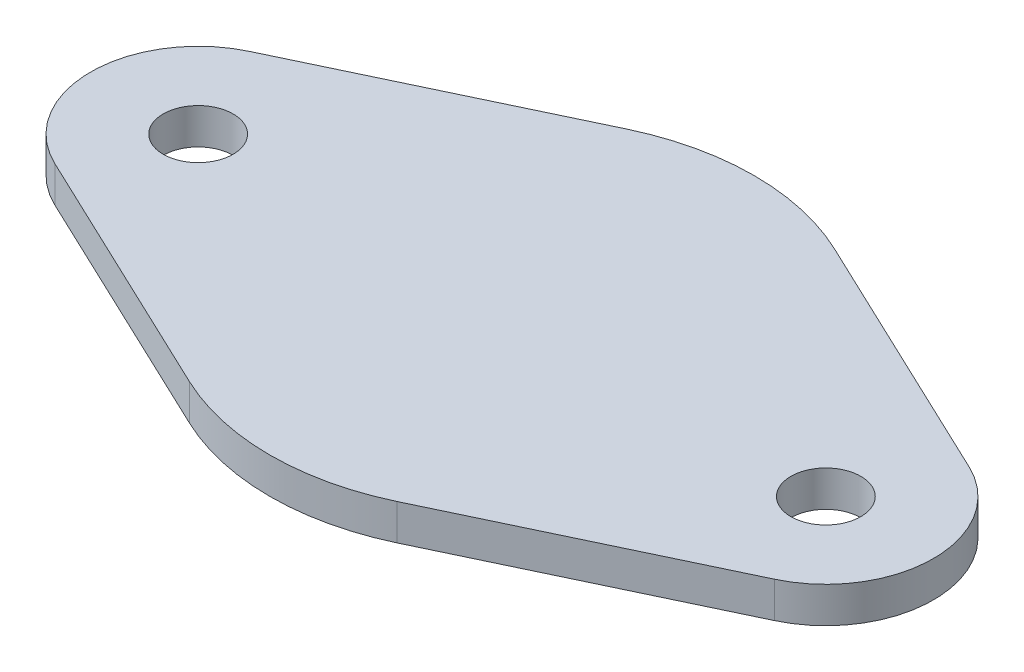
from build123d import *

# Parameters (mm, degrees)
SKETCH_1_R      = 1.95
EXTRUDE_1_DEPTH = 2


with BuildPart() as part:
    # 草图1 → 凸台-拉伸1 (new body)
    with BuildSketch(Plane(origin=(0, 0, 0), x_dir=(1, 0, 0), z_dir=(0, 1, 0))):
        with BuildLine():
            Line((-5.785714286, 12.197356689), (-20.071428571, 5.421047417))
            ThreePointArc((-20.071428571, 5.421047417), (-23.5, 0), (-20.071428571, -5.421047417))
            Line((-20.071428571, -5.421047417), (-5.785714286, -12.197356689))
            ThreePointArc((-5.785714286, -12.197356689), (0, -13.5), (5.785714286, -12.197356689))
            Line((5.785714286, -12.197356689), (20.071428571, -5.421047417))
            ThreePointArc((20.071428571, -5.421047417), (23.5, 0), (20.071428571, 5.421047417))
            Line((20.071428571, 5.421047417), (5.785714286, 12.197356689))
            ThreePointArc((5.785714286, 12.197356689), (0, 13.5), (-5.785714286, 12.197356689))
        make_face()
        with Locations(Location((-17.5, 0, 0), (0, 0, 270))):
            Circle(SKETCH_1_R, mode=Mode.SUBTRACT)
        with Locations(Location((17.5, 0, 0), (0, 0, 270))):
            Circle(SKETCH_1_R, mode=Mode.SUBTRACT)
    extrude(amount=EXTRUDE_1_DEPTH)


solid = part.part
